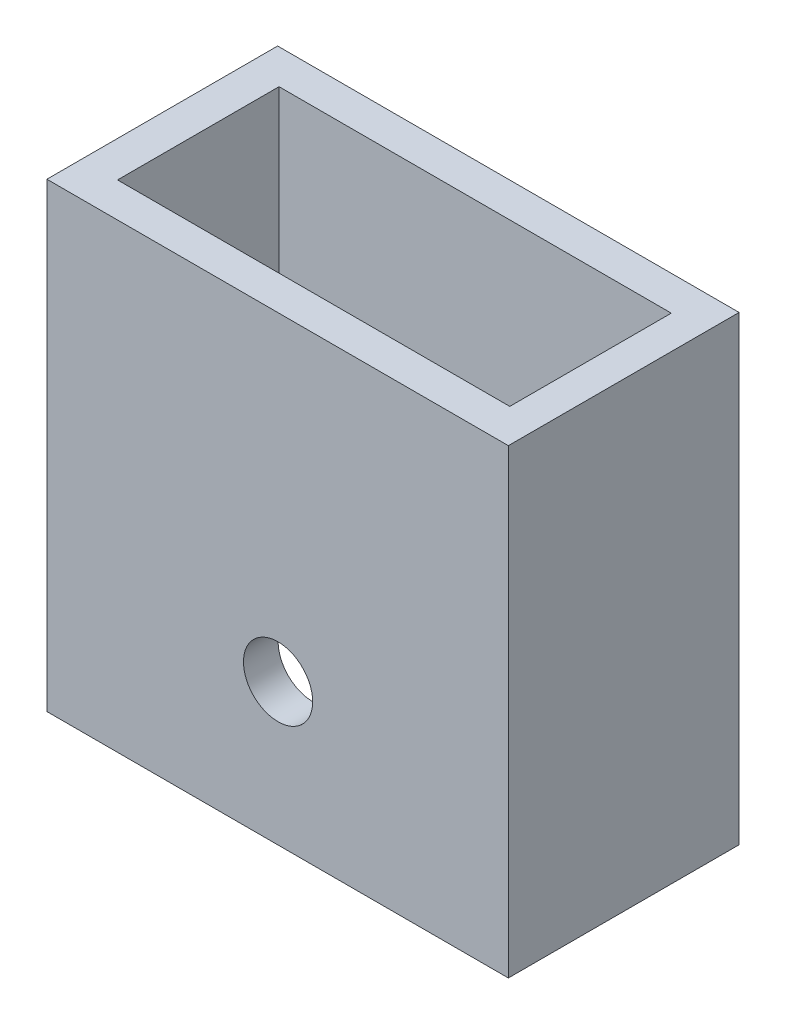
from build123d import *

# Parameters (mm, degrees)
SKETCH1_W           = 40
SKETCH1_H           = 39.961960623
BOSS_EXTRUDE1_DEPTH = 20
SKETCH2_W           = 34
SKETCH2_H           = 14
CUT_EXTRUDE8_DEPTH  = 200
SKETCH11_R          = 3
CUT_EXTRUDE9_DEPTH  = 200


with BuildPart() as part:
    # Sketch1 → Boss-Extrude1 (new body)
    with BuildSketch(Plane.XY):
        with Locations((-54.687727825, -45.505163644)):
            Rectangle(SKETCH1_W, SKETCH1_H)
    extrude(amount=BOSS_EXTRUDE1_DEPTH)

    # Sketch2 → Cut-Extrude8 (cut)
    with BuildSketch(Plane(origin=(0, 0, 0), x_dir=(1, 0, 0), z_dir=(0, 1, 0))):
        with Locations((-54.573337213, -9.992843295)):
            Rectangle(SKETCH2_W, SKETCH2_H)
    extrude(amount=-CUT_EXTRUDE8_DEPTH, mode=Mode.SUBTRACT)

    # Sketch11 → Cut-Extrude9 (cut)
    with BuildSketch(Plane.XY.offset(20)):
        with Locations((-54.650409989, -53.230441293)):
            Circle(SKETCH11_R)
    extrude(amount=-CUT_EXTRUDE9_DEPTH, mode=Mode.SUBTRACT)


solid = part.part
